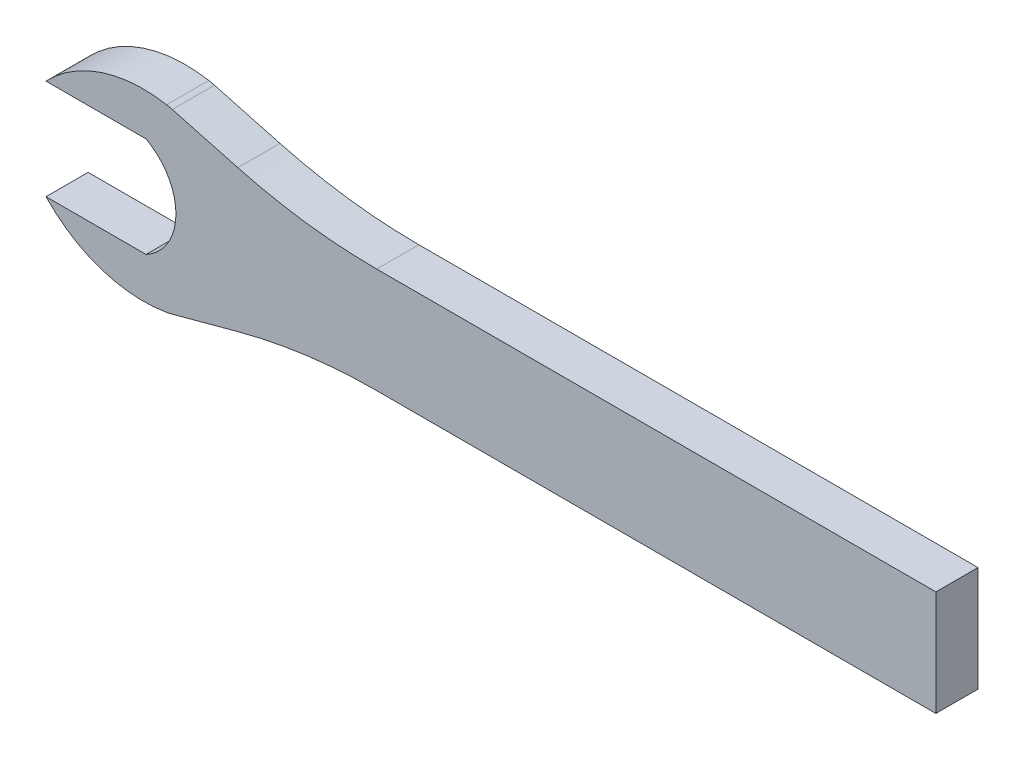
from build123d import *

# Parameters (mm, degrees)
BOSS_EXTRUDE1_DEPTH = 4
BOSS_EXTRUDE2_DEPTH = 4


with BuildPart() as part:
    # Sketch1 → Boss-Extrude1 (new, symmetric)
    with BuildSketch(Plane(origin=(0, 0, 0), x_dir=(1, 0, 0), z_dir=(0, 0, -1))):
        with BuildLine():
            ThreePointArc((3.912406176, 17.070771576), (-8.500253603, 16.1800345), (-19, 9.5))
            Line((-19, 9.5), (0, 9.5))
            ThreePointArc((0, 9.5), (5.676596321, 0), (0, -9.5))
            Line((0, -9.5), (-19, -9.5))
            ThreePointArc((-19, -9.5), (-8.500253603, -16.1800345), (3.912406176, -17.070771576))
            ThreePointArc((3.912406176, -17.070771576), (9.768875106, -14.366169937), (13.541125507, -9.133271576))
            ThreePointArc((13.541125507, -9.133271576), (15.24, 0), (13.541125507, 9.133271576))
            ThreePointArc((13.541125507, 9.133271576), (9.768875106, 14.366169937), (3.912406176, 17.070771576))
        make_face()
    extrude(amount=BOSS_EXTRUDE1_DEPTH, both=True)

    # Sketch2 → Boss-Extrude2 (add, symmetric)
    with BuildSketch(Plane(origin=(0, 0, 0), x_dir=(1, 0, 0), z_dir=(0, 0, -1))):
        with BuildLine():
            Line((128.204707639, 10), (43.812088921, 10))
            ThreePointArc((43.812088921, 10), (30.504452796, 10.875291905), (17.426109311, 13.486086206))
            Line((17.426109311, 13.486086206), (4.988810205, 16.830875012))
            ThreePointArc((4.988810205, 16.830875012), (10.186731733, 14.006186237), (13.541125507, 9.133271576))
            ThreePointArc((13.541125507, 9.133271576), (15.24, 0), (13.541125507, -9.133271576))
            ThreePointArc((13.541125507, -9.133271576), (10.186731733, -14.006186237), (4.988810205, -16.830875012))
            Line((4.988810205, -16.830875012), (17.426109311, -13.486086206))
            ThreePointArc((17.426109311, -13.486086206), (30.504452796, -10.875291905), (43.812088921, -10))
            Line((43.812088921, -10), (128.204707639, -10))
            Line((128.204707639, -10), (150, -10))
            Line((150, -10), (150, 10))
            Line((150, 10), (128.204707639, 10))
        make_face()
    extrude(amount=BOSS_EXTRUDE2_DEPTH, both=True)


solid = part.part
